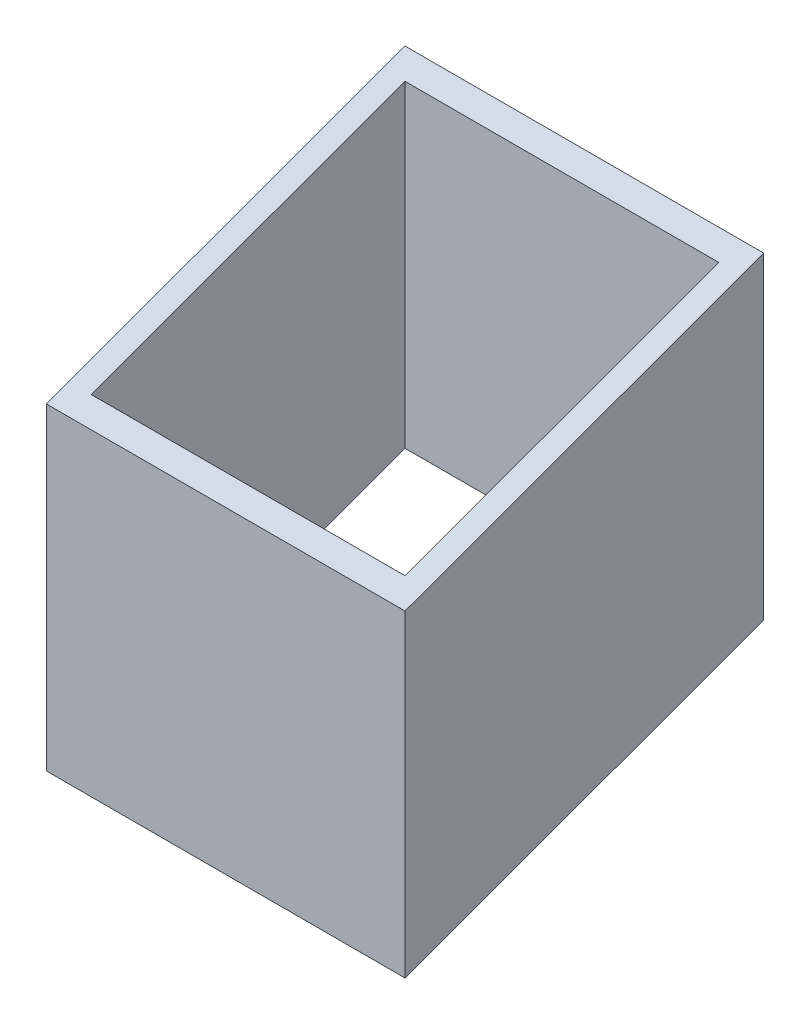
from build123d import *

# Parameters (mm, degrees)
SKETCH1_W           = 40
SKETCH1_H           = 40
BOSS_EXTRUDE1_DEPTH = 50
SKETCH2_W           = 35
SKETCH2_H           = 35
CUT_EXTRUDE1_DEPTH  = 76.498344353
CUT_EXTRUDE2_DEPTH  = 76.498344353


with BuildPart() as part:
    # Sketch1 → Boss-Extrude1 (new body)
    with BuildSketch(Plane(origin=(0, 0, 0), x_dir=(1, 0, 0), z_dir=(0, 1, 0))):
        with Locations((20, 20)):
            Rectangle(SKETCH1_W, SKETCH1_H)
    extrude(amount=BOSS_EXTRUDE1_DEPTH)

    # Sketch2 → Cut-Extrude1 (cut, through all)
    with BuildSketch(Plane.XZ):
        with Locations((20, -20)):
            Rectangle(SKETCH2_W, SKETCH2_H)
    extrude(amount=-CUT_EXTRUDE1_DEPTH, mode=Mode.SUBTRACT)

    # Sketch3 → Cut-Extrude2 (cut, through all)
    with BuildSketch(Plane.ZY):
        Polygon((-40, 0), (0, 0), (-40, 14.558809371), align=None)
        Polygon((-40, 50), (0, 35.441190629), (0, 50), align=None)
    extrude(amount=-CUT_EXTRUDE2_DEPTH, mode=Mode.SUBTRACT)


solid = part.part
